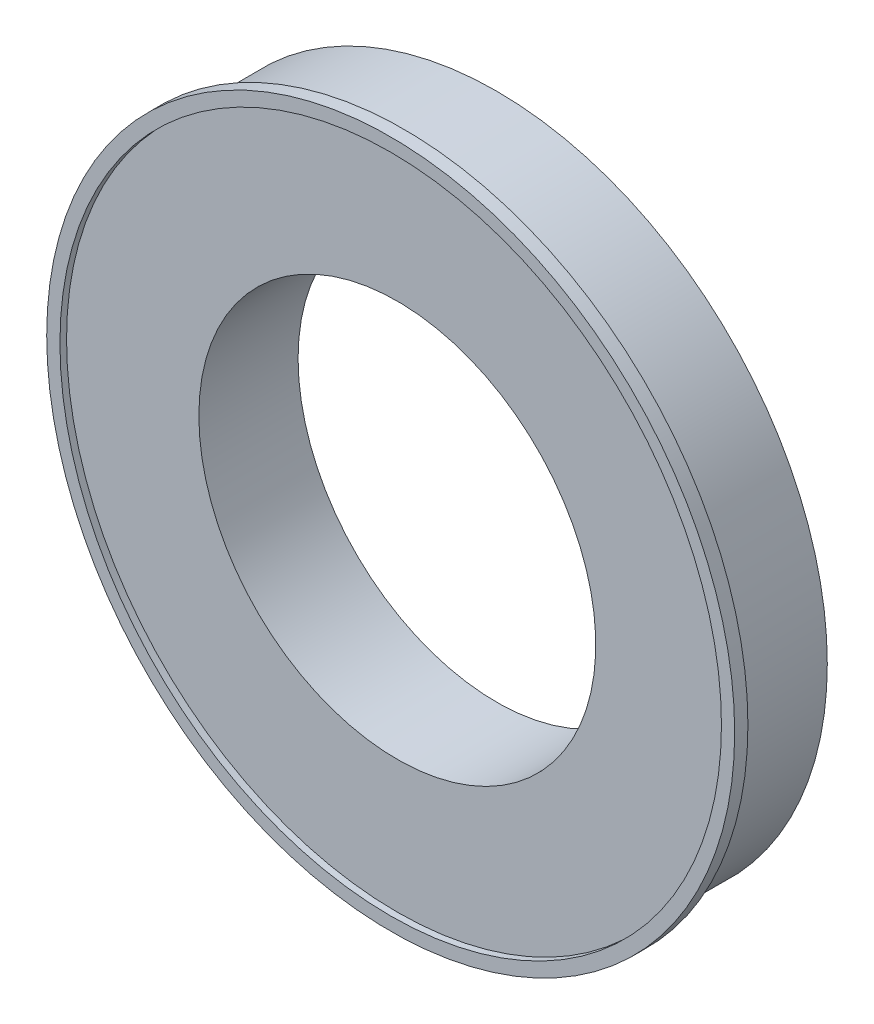
from build123d import *

# Parameters (mm, degrees)
SKETCH1_R           = 63.5
SKETCH1_R_2         = 38.1
BOSS_EXTRUDE1_DEPTH = 9.525
SKETCH2_R           = 66.04
SKETCH2_R_2         = 63.5
BOSS_EXTRUDE2_DEPTH = 1.27


with BuildPart() as part:
    # Sketch1 → Boss-Extrude1 (new, symmetric)
    with BuildSketch(Plane.XY):
        with Locations(Location((0, 0, 0), (0, 0, 180))):
            Circle(SKETCH1_R)
        with Locations(Location((0, 0, 0), (0, 0, 180))):
            Circle(SKETCH1_R_2, mode=Mode.SUBTRACT)
    extrude(amount=BOSS_EXTRUDE1_DEPTH, both=True)

    # Sketch2 → Boss-Extrude2 (add, symmetric)
    with BuildSketch(Plane.XY.offset(9.525)):
        Circle(SKETCH2_R)
        with Locations(Location((0, 0, 0), (0, 0, 180))):
            Circle(SKETCH2_R_2, mode=Mode.SUBTRACT)
    extrude(amount=BOSS_EXTRUDE2_DEPTH, both=True)


solid = part.part
